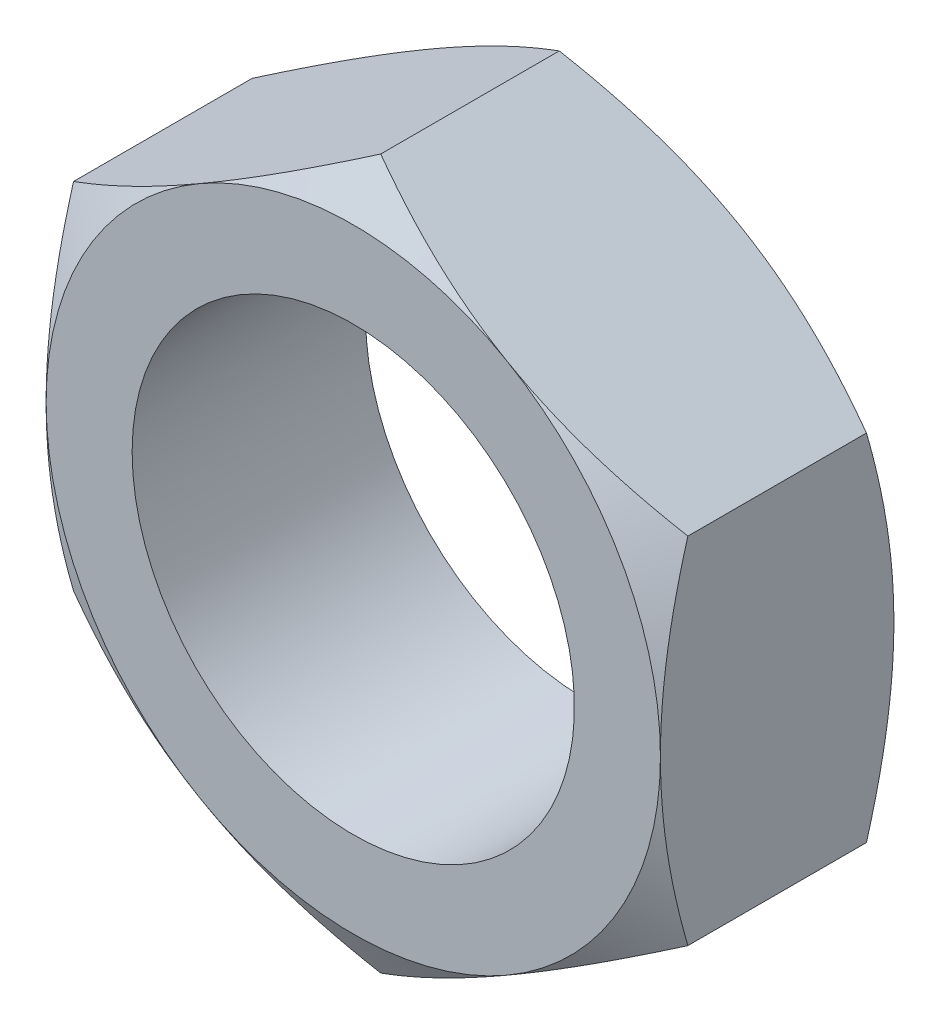
from build123d import *

# Parameters (mm, degrees)
EXTRUDE1_DEPTH          = 2.183100002
SKETCH13_R              = 4.1364
BOSS_EXTRUDE1_DEPTH     = 4.3662
SKETCH7_OUTSIDE_W       = 105.096
SKETCH7_OUTSIDE_H       = 106.874
SKETCH7_OUTSIDE_R       = 5.745
EXTRUDE2_DEPTH          = 25.4
EXTRUDE2_DRAFT          = -60
MIRROR2_COPY_1_SKETCH_W = 105.096
MIRROR2_COPY_1_SKETCH_H = 106.874
MIRROR2_COPY_1_SKETCH_R = 5.745
MIRROR2_COPY_1_DEPTH    = 25.4
MIRROR2_COPY_1_DRAFT    = -60


with BuildPart() as part:
    # Sketch1 → Extrude1 (new, symmetric)
    with BuildSketch(Plane.XY):
        Polygon((-5.745, 3.316877296), (-5.745, -3.316877296), (0, -6.633754593), (5.745, -3.316877296), (5.745, 3.316877296), (0, 6.633754593), align=None)
    extrude(amount=EXTRUDE1_DEPTH, both=True)

    # Cut-Extrude2 cone 1 section (through the dimple's axis) → Cut-Extrude2 (revolve, cut)
    with BuildSketch(Plane(origin=(0, 0, 2.183100002), x_dir=(0, -1, 0), z_dir=(1, 0, 0))):
        Polygon((0, 0), (4.1364, 0), (0, 4.1364), align=None)
    revolve(axis=Axis((0, 0, 2.183100002), (0, 0, -1)), mode=Mode.SUBTRACT)

    # Cut-Extrude3 cone 1 section (through the dimple's axis) → Cut-Extrude3 (revolve, cut)
    with BuildSketch(Plane(origin=(0, 0, -2.183100002), x_dir=(0, 1, 0), z_dir=(1, 0, 0))):
        Polygon((0, 0), (4.1364, 0), (0, 4.1364), align=None)
    revolve(axis=Axis((0, 0, -2.183100002), (0, 0, 1)), mode=Mode.SUBTRACT)


with BuildPart() as body_2:
    # Sketch13 → Boss-Extrude1 (new body)
    with BuildSketch(Plane(origin=(0, 0, -2.183100002), x_dir=(-1, 0, 0), z_dir=(0, 0, -1))):
        Circle(SKETCH13_R)
    extrude(amount=-BOSS_EXTRUDE1_DEPTH)


with BuildPart() as part_1:
    add(part.part)

    # Combine1: cut body 2
    add(body_2.part, mode=Mode.SUBTRACT)


with BuildPart() as extrude2_tool:
    # Sketch7 outside → Extrude2 (with draft: the straight prism first)
    with BuildSketch(Plane.XY.offset(2.183100002)):
        Rectangle(SKETCH7_OUTSIDE_W, SKETCH7_OUTSIDE_H)
        Circle(SKETCH7_OUTSIDE_R, mode=Mode.SUBTRACT)
    extrude(amount=-EXTRUDE2_DEPTH)
    # Extrude2: the draft: its side faces are tilted about the plane it starts from
    extrude2_sides = [extrude2_tool.faces().sort_by_distance(p)[0] for p in [
        (0, -53.437, -10.516899998),
        (52.548, 0, -10.516899998),
        (0, 53.437, -10.516899998),
        (-52.548, 0, -10.516899998),
        (-5.745, 0, -10.516899998),
    ]]
    draft(extrude2_sides, Plane.XY.offset(2.183100002), EXTRUDE2_DRAFT)


with BuildPart() as part_2:
    add(part_1.part)

    # Extrude2: cut by extrude2_tool
    add(extrude2_tool.part, mode=Mode.SUBTRACT)


with BuildPart() as mirror2_copy_1_tool:
    # Mirror2 copy 1 sketch → Mirror2 copy 1 (with draft: the straight prism first)
    with BuildSketch(Plane(origin=(0, 0, -2.183100002), x_dir=(1, 0, 0), z_dir=(0, 0, -1))):
        Rectangle(MIRROR2_COPY_1_SKETCH_W, MIRROR2_COPY_1_SKETCH_H)
        Circle(MIRROR2_COPY_1_SKETCH_R, mode=Mode.SUBTRACT)
    extrude(amount=-MIRROR2_COPY_1_DEPTH)
    # Mirror2 copy 1: the draft: its side faces are tilted about the plane it starts from
    mirror2_copy_1_sides = [mirror2_copy_1_tool.faces().sort_by_distance(p)[0] for p in [
        (0, -53.437, 10.516899998),
        (52.548, 0, 10.516899998),
        (0, 53.437, 10.516899998),
        (-52.548, 0, 10.516899998),
        (-5.745, 0, 10.516899998),
    ]]
    draft(mirror2_copy_1_sides, Plane(origin=(0, 0, -2.183100002), x_dir=(1, 0, 0), z_dir=(0, 0, -1)), MIRROR2_COPY_1_DRAFT)


with BuildPart() as part_3:
    add(part_2.part)

    # Mirror2 copy 1: cut by mirror2_copy_1_tool
    add(mirror2_copy_1_tool.part, mode=Mode.SUBTRACT)


solid = part_3.part
